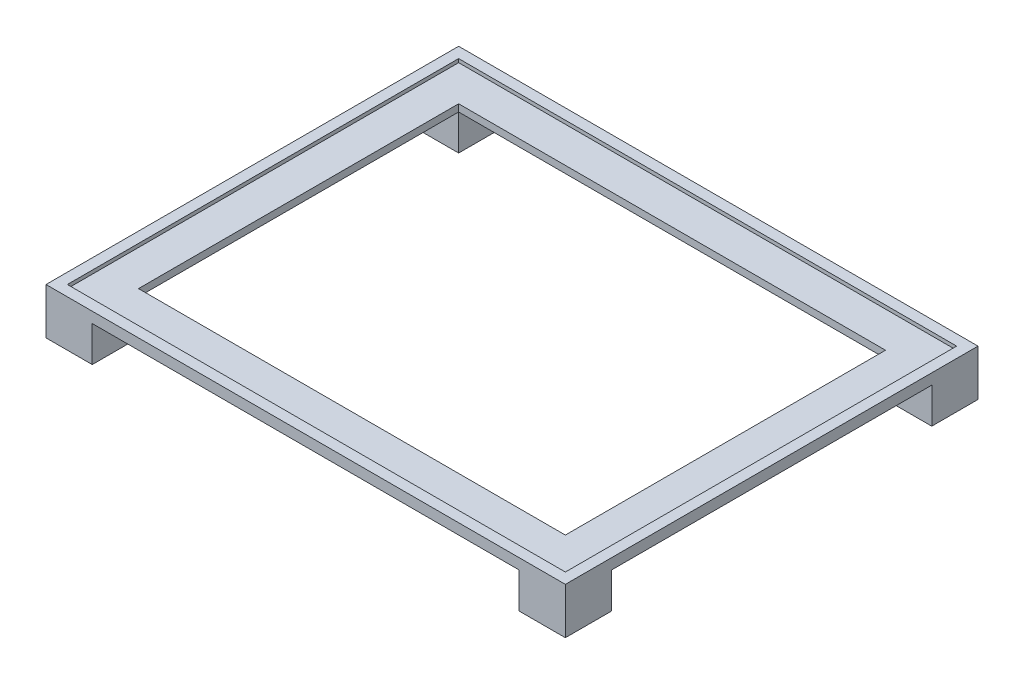
from build123d import *

# Parameters (mm, degrees)
SKETCH1_W      = 146
SKETCH1_H      = 116
SKETCH1_W_2    = 140
SKETCH1_H_2    = 110
DINDING_DEPTH  = 3
SKETCH1_4_W    = 140
SKETCH1_4_H    = 110
SKETCH1_4_W_2  = 120
SKETCH1_4_H_2  = 90
LANDSITE_DEPTH = 2
SKETCH2_W      = 13
SKETCH2_H      = 13
KAKI_DEPTH     = 10


with BuildPart() as part:
    # Sketch1 → Dinding (new body)
    with BuildSketch(Plane(origin=(0, 0, 0), x_dir=(1, 0, 0), z_dir=(0, 1, 0))):
        Rectangle(SKETCH1_W, SKETCH1_H)
        Rectangle(SKETCH1_W_2, SKETCH1_H_2, mode=Mode.SUBTRACT)
    extrude(amount=DINDING_DEPTH)

    # Sketch1<4> → Landsite (add)
    with BuildSketch(Plane(origin=(0, 0, 0), x_dir=(1, 0, 0), z_dir=(0, 1, 0))):
        Rectangle(SKETCH1_4_W, SKETCH1_4_H)
        Rectangle(SKETCH1_4_W_2, SKETCH1_4_H_2, mode=Mode.SUBTRACT)
    extrude(amount=LANDSITE_DEPTH)

    # Sketch2 → Kaki (add)
    with BuildSketch(Plane.XZ):
        with Locations((-66.5, 51.5)):
            Rectangle(SKETCH2_W, SKETCH2_H)
        with Locations((66.5, 51.5)):
            Rectangle(SKETCH2_W, SKETCH2_H)
        with Locations((-66.5, -51.5)):
            Rectangle(SKETCH2_W, SKETCH2_H)
        with Locations((66.5, -51.5)):
            Rectangle(SKETCH2_W, SKETCH2_H)
    extrude(amount=KAKI_DEPTH)


solid = part.part
